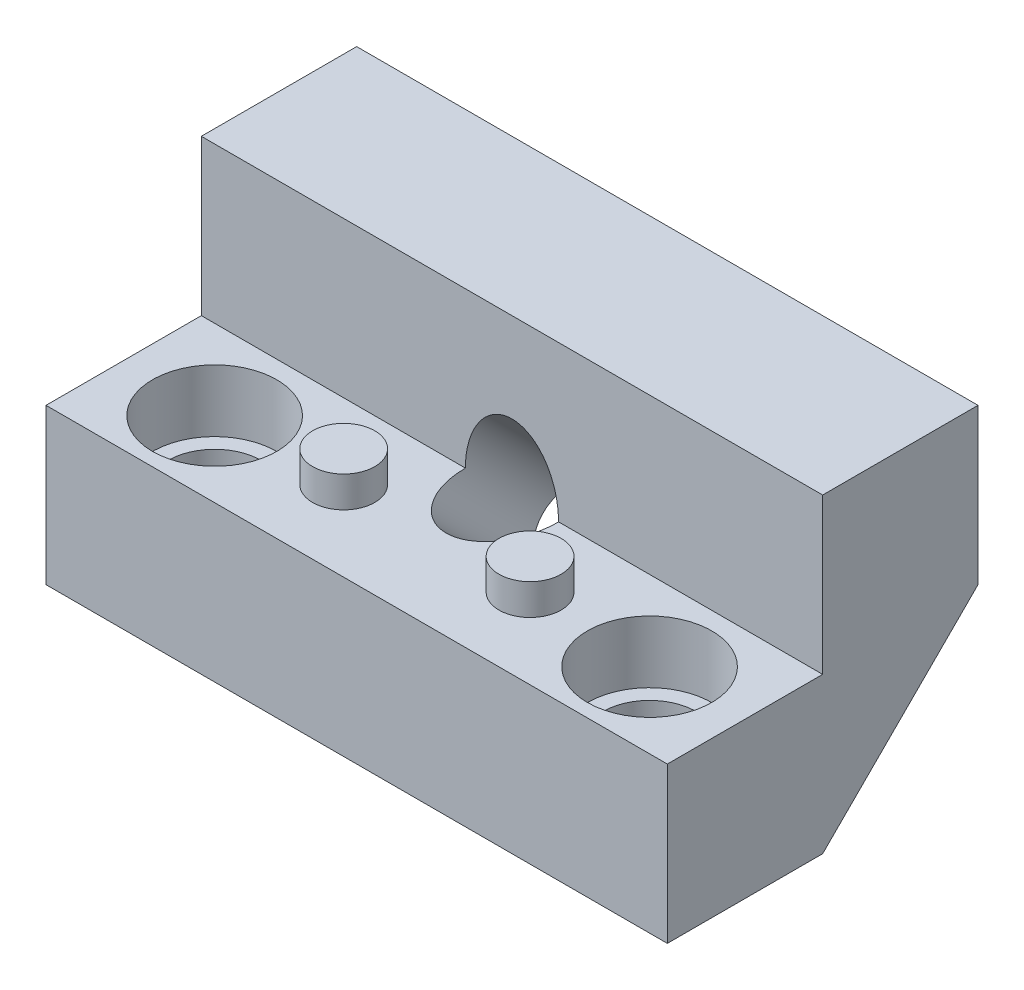
from build123d import *

# Parameters (mm, degrees)
SKETCH1_W                      = 254
SKETCH1_H                      = 127
RECTANGLE_PRISON_DEPTH         = 127
TOP_SQUARE_CUT_DEPTH           = 291.99355663
TOP_SQUARE_CUT_DEPTH_BACK      = 291.99355663
BUTTOM_TRI_CUT_DEPTH           = 291.99355663
BUTTOM_TRI_CUT_DEPTH_BACK      = 291.99355663
SKETCH8_R                      = 25.4
OUTER_CIRCLE_CUT_DEPTH         = 25.4
SKETCH9_R                      = 19.05
INNER_CIRCLE_CUT_DEPTH         = 168.52450567
SKETCH11_R                     = 12.7
TWO_CIRCLES_OUT_DEPTH          = 12.7
SKETCH12_R                     = 19.05
CIRCLE_CUT_IN_THE_MIDDLE_DEPTH = 191.5


with BuildPart() as part:
    # Sketch1 → Rectangle prison (new body)
    with BuildSketch(Plane(origin=(0, 0, 0), x_dir=(1, 0, 0), z_dir=(0, 1, 0))):
        Rectangle(SKETCH1_W, SKETCH1_H)
    extrude(amount=RECTANGLE_PRISON_DEPTH)

    # Sketch6 → Top square cut (cut, two sides: drawn at the far end of the back side and taken through both)
    with BuildSketch(Plane(origin=(127, 0, 0), x_dir=(0, 0, -1), z_dir=(1, 0, 0)).offset(-TOP_SQUARE_CUT_DEPTH_BACK)):
        Polygon((-357.480633142, 63.5), (-63.5, 63.5), (0, 63.5), (0, 127), (0, 420.980633142), (-415.751398465, 836.732031608), (-773.232031608, 479.251398465), align=None)
    extrude(amount=TOP_SQUARE_CUT_DEPTH + TOP_SQUARE_CUT_DEPTH_BACK, mode=Mode.SUBTRACT)

    # Sketch7 → Buttom tri cut (cut, two sides: drawn at the far end of the back side and taken through both)
    with BuildSketch(Plane(origin=(127, 0, 0), x_dir=(0, 0, -1), z_dir=(1, 0, 0)).offset(-BUTTOM_TRI_CUT_DEPTH_BACK)):
        Polygon((-207.875699233, -207.875699233), (0, 0), (63.5, 63.5), (271.375699233, 271.375699233), (687.127097698, -144.375699233), (207.875699233, -623.627097698), align=None)
    extrude(amount=BUTTOM_TRI_CUT_DEPTH + BUTTOM_TRI_CUT_DEPTH_BACK, mode=Mode.SUBTRACT)

    # Sketch8 → outer circle cut (cut)
    with BuildSketch(Plane(origin=(0, 63.5, 0), x_dir=(1, 0, 0), z_dir=(0, 1, 0))):
        with Locations(Location((-88.9, -32.658118373, 0), (0, 0, 270))):
            Circle(SKETCH8_R)
        with Locations(Location((88.9, -32.658118373, 0), (0, 0, 270))):
            Circle(SKETCH8_R)
    extrude(amount=-OUTER_CIRCLE_CUT_DEPTH, mode=Mode.SUBTRACT)

    # Sketch9 → inner circle cut (cut, through all)
    with BuildSketch(Plane(origin=(0, 38.1, 0), x_dir=(1, 0, 0), z_dir=(0, 1, 0))):
        with Locations(Location((-88.9, -32.658118373, 0), (0, 0, 270))):
            Circle(SKETCH9_R)
        with Locations(Location((88.9, -32.658118373, 0), (0, 0, 270))):
            Circle(SKETCH9_R)
    extrude(amount=-INNER_CIRCLE_CUT_DEPTH, mode=Mode.SUBTRACT)

    # Sketch11 → Two circles out (add)
    with BuildSketch(Plane(origin=(0, 63.5, 0), x_dir=(1, 0, 0), z_dir=(0, 1, 0))):
        with Locations(Location((-38.1, -30.71024924, 0), (0, 0, 270))):
            Circle(SKETCH11_R)
        with Locations(Location((38.1, -30.71024924, 0), (0, 0, 270))):
            Circle(SKETCH11_R)
    extrude(amount=TWO_CIRCLES_OUT_DEPTH)

    # Sketch12 → Circle cut in the middle (cut, through all)
    with BuildSketch(Plane(origin=(0, 0, 0), x_dir=(1, 0, 0), z_dir=(0, -0.7071067811865475, -0.7071067811865476))):
        with Locations(Location((0, -44.901280605, 0), (0, 0, 270))):
            Circle(SKETCH12_R)
    extrude(amount=-CIRCLE_CUT_IN_THE_MIDDLE_DEPTH, mode=Mode.SUBTRACT)


solid = part.part
